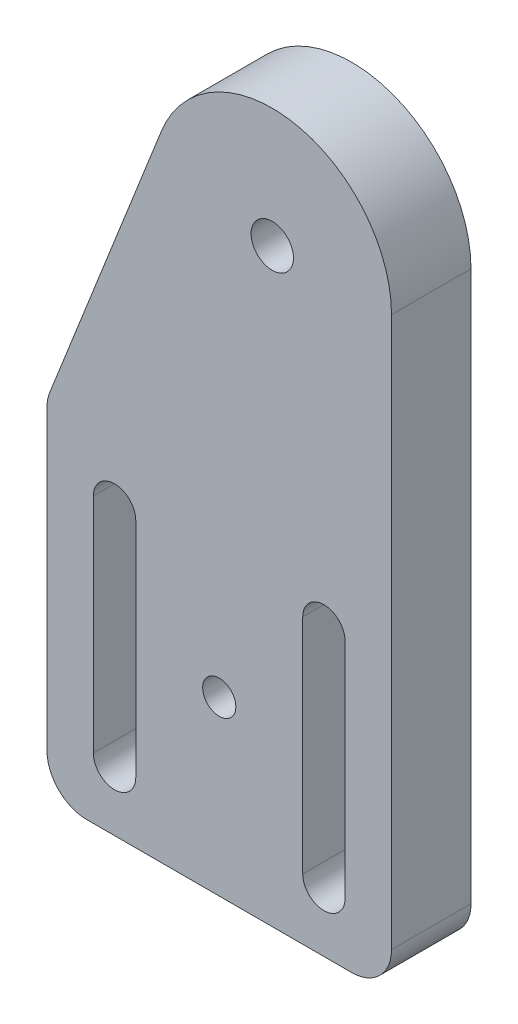
from build123d import *

# Parameters (mm, degrees)
EXTRUDE_1_DEPTH      = 6
SKETCH_1_4_R         = 3
CUT_EXTRUDE_1_DEPTH  = 3
M3X0_5_1_D           = 2.5
M3X0_5_1_ON_FACE_2_D = 2.5
HOLE_WIZARD_M3_1_D   = 3.2
FILLET_1_R           = 3


with BuildPart() as part:
    # ｽｹｯﾁ1 → ﾎﾞｽ - 押し出し1 (new body)
    with BuildSketch(Plane.XY):
        with BuildLine():
            Line((13, -18.5), (13, -44.5))
            Line((13, -44.5), (-13, -44.5))
            Line((-13, -44.5), (-13, -18.5))
            Line((-13, -18.5), (-4.368567869, 3.311656961))
            ThreePointArc((-4.368567869, 3.311656961), (5.685658503, 8.840732742), (13, 0))
            Line((13, 0), (13, -18.5))
        make_face()
        with BuildLine():
            Line((-6.3, -23.1), (-6.3, -39.9))
            ThreePointArc((-6.3, -39.9), (-7.9, -41.5), (-9.5, -39.9))
            Line((-9.5, -39.9), (-9.5, -23.1))
            ThreePointArc((-9.5, -23.1), (-7.9, -21.5), (-6.3, -23.1))
        make_face(mode=Mode.SUBTRACT)
        with BuildLine():
            Line((9.5, -23.1), (9.5, -39.9))
            ThreePointArc((9.5, -39.9), (7.9, -41.5), (6.3, -39.9))
            Line((6.3, -39.9), (6.3, -23.1))
            ThreePointArc((6.3, -23.1), (7.9, -21.5), (9.5, -23.1))
        make_face(mode=Mode.SUBTRACT)
    extrude(amount=EXTRUDE_1_DEPTH)

    # ｽｹｯﾁ1<4> → ｶｯﾄ - 押し出し1 (cut)
    with BuildSketch(Plane.XY):
        with Locations((4, 0)):
            Circle(SKETCH_1_4_R)
    extrude(amount=CUT_EXTRUDE_1_DEPTH, mode=Mode.SUBTRACT)

    # M3x0.5 ねじ穴1 (through all)
    with Locations(Plane(origin=(0, -31.5, 6), x_dir=(1, 0, 0), z_dir=(0, 0, 1))):
        with Locations((0, 0)):
            Hole(M3X0_5_1_D / 2)

    # M3x0.5 ねじ穴1 on face 2 (through all)
    with Locations(Plane(origin=(-14.647964035, 19.095875402, 0), x_dir=(1, 0, 0), z_dir=(0, 0, 1))):
        with Locations((0, 0)):
            Hole(M3X0_5_1_ON_FACE_2_D / 2)

    # M3 すきま穴1 (through all)
    with Locations(Plane.XY.offset(6)):
        with Locations((4, 0)):
            Hole(HOLE_WIZARD_M3_1_D / 2)

    # ﾌｨﾚｯﾄ1
    fillet_1_edges = [part.edges().sort_by_distance(p)[0] for p in [
        (13, -44.5, 3),
        (-13, -44.5, 3),
        (-13, -18.5, 3),
    ]]
    fillet(fillet_1_edges, radius=FILLET_1_R)


solid = part.part
